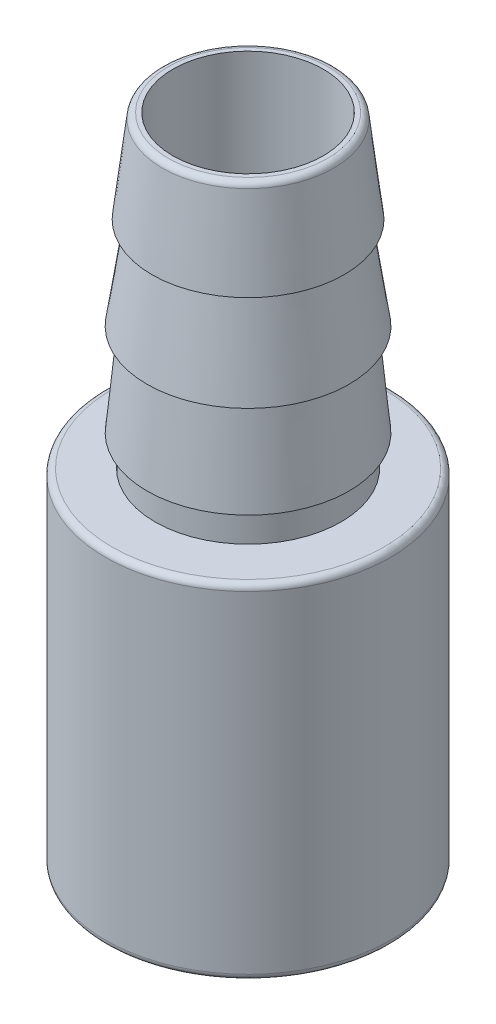
from build123d import *

# Parameters (mm, degrees)
REDONDEO2_R           = 0.5
CROQUIS1_R            = 1
CORTAR_EXTRUIR1_DEPTH = 56.360291205
REDONDEO4_R           = 0.5


with BuildPart() as part:
    # Sketch3 → Revolve1 (revolve)
    with BuildSketch(Plane.XY, mode=Mode.PRIVATE) as revolve1_sk:
        Polygon((7.8, 45.39571665), (7.1, 45.39571665), (8.2, 37.89571665), (7.5, 37.89571665), (8.2, 30.39571665), (7.55, 30.39571665), (7.55, 27.89571665), (11.55, 27.89571665), (11.55, 0), (7.55, 0), (7.55, 25.89571665), (6.1, 25.89571665), (6.1, 52.89571665), (6.9, 52.89571665), align=None)
    revolve(revolve1_sk.sketch.rotate(Axis((0, 70.39571665, 0), (0, -1, 0)), 90), axis=Axis((0, 70.39571665, 0), (0, -1, 0)))

    # Redondeo2
    redondeo2_edges = [part.edges().sort_by_distance(p)[0] for p in [
        (0, 27.89571665, -11.55),
        (0, 0, -11.55),
        (0, 0, -7.55),
    ]]
    fillet(redondeo2_edges, radius=REDONDEO2_R)

    # Croquis1 → Cortar-Extruir1 (cut, through all)
    with BuildSketch(Plane.XY):
        with Locations((0, 13.674991935)):
            Circle(CROQUIS1_R)
    extrude(amount=-CORTAR_EXTRUIR1_DEPTH, mode=Mode.SUBTRACT)

    # Redondeo4
    redondeo4_edges = [part.edges().sort_by_distance(p)[0] for p in [
        (0, 52.89571665, -6.9),
    ]]
    fillet(redondeo4_edges, radius=REDONDEO4_R)


solid = part.part
